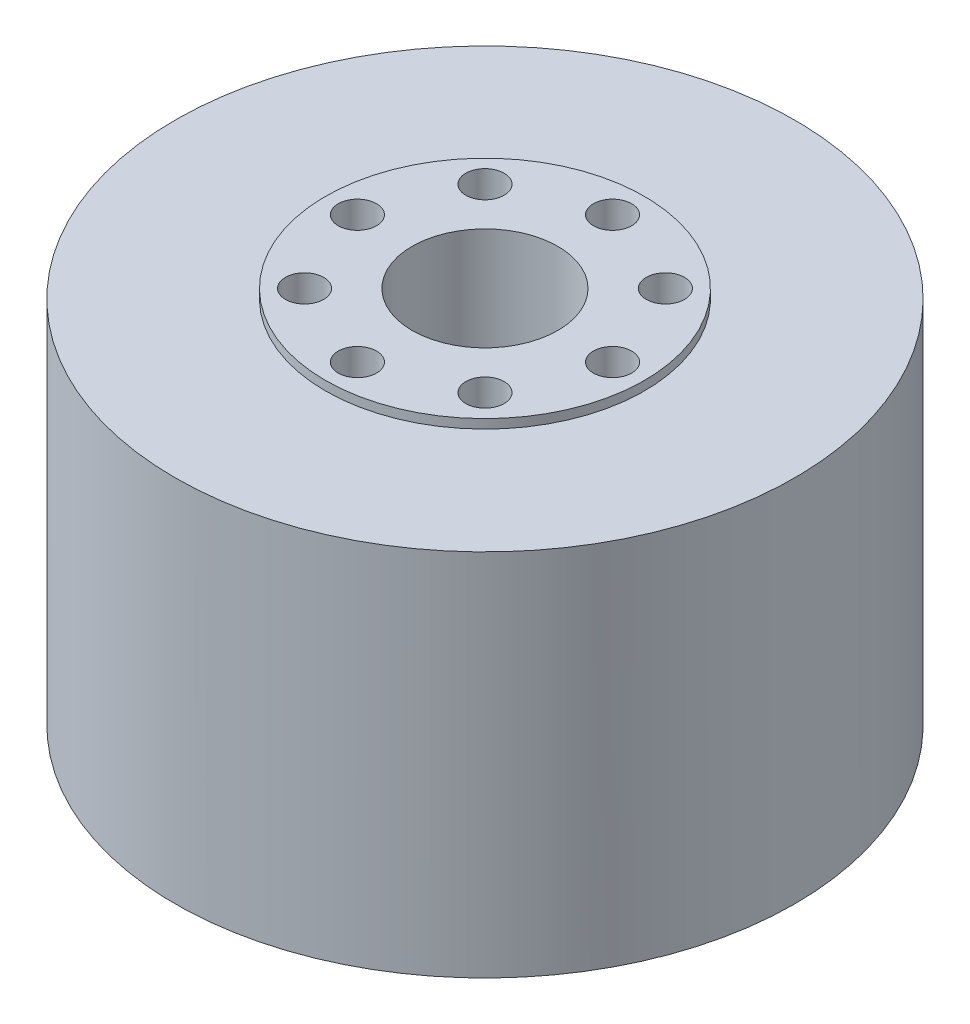
from build123d import *

# Parameters (mm, degrees)
SKETCH_1_R          = 34
SKETCH_1_R_2        = 8
EXTRUDE_1_DEPTH     = 40.5
SKETCH_2_R          = 17.5
SKETCH_2_R_2        = 8
EXTRUDE_2_DEPTH     = 1
SKETCH_3_R          = 2.1
CUT_EXTRUDE_1_DEPTH = 5
CUT_EXTRUDE_2_DEPTH = 8
SKETCH_5_R          = 2.1
CUT_EXTRUDE_3_DEPTH = 5


with BuildPart() as part:
    # 草图1 → 凸台-拉伸1 (new body)
    with BuildSketch(Plane(origin=(0, 0, 0), x_dir=(1, 0, 0), z_dir=(0, 1, 0))):
        with Locations(Location((0, 0, 0), (0, 0, 270))):
            Circle(SKETCH_1_R)
        with Locations(Location((0, 0, 0), (0, 0, 270))):
            Circle(SKETCH_1_R_2, mode=Mode.SUBTRACT)
    extrude(amount=EXTRUDE_1_DEPTH)

    # 草图2 → 凸台-拉伸2 (add)
    with BuildSketch(Plane(origin=(0, 40.5, 0), x_dir=(1, 0, 0), z_dir=(0, 1, 0))):
        with Locations(Location((0, 0, 0), (0, 0, 270))):
            Circle(SKETCH_2_R)
        with Locations(Location((0, 0, 0), (0, 0, 270))):
            Circle(SKETCH_2_R_2, mode=Mode.SUBTRACT)
    extrude(amount=EXTRUDE_2_DEPTH)

    # 草图3 → 切除-拉伸1 (cut)
    with BuildSketch(Plane(origin=(0, 41.5, 0), x_dir=(1, 0, 0), z_dir=(0, 1, 0))):
        with Locations(Location((14, 0, 0), (0, 0, 270))):
            Circle(SKETCH_3_R)
        with Locations(Location((9.899494937, -9.899494937, 0), (0, 0, 270))):
            Circle(SKETCH_3_R)
        with Locations(Location((0, -14, 0), (0, 0, 270))):
            Circle(SKETCH_3_R)
        with Locations(Location((-9.899494937, -9.899494937, 0), (0, 0, 270))):
            Circle(SKETCH_3_R)
        with Locations(Location((-14, 0, 0), (0, 0, 270))):
            Circle(SKETCH_3_R)
        with Locations(Location((-9.899494937, 9.899494937, 0), (0, 0, 270))):
            Circle(SKETCH_3_R)
        with Locations(Location((0, 14, 0), (0, 0, 270))):
            Circle(SKETCH_3_R)
        with Locations(Location((9.899494937, 9.899494937, 0), (0, 0, 270))):
            Circle(SKETCH_3_R)
    extrude(amount=-CUT_EXTRUDE_1_DEPTH, mode=Mode.SUBTRACT)

    # 草图4 → 切除-拉伸2 (cut)
    with BuildSketch(Plane(origin=(0, 0, 0), x_dir=(-1, 0, 0), z_dir=(0, -1, 0))):
        Polygon((28.844410204, 191.136996342), (28.844410204, 18), (28.844410204, -18), (28.844410204, -191.136996342), (375.118402887, -191.136996342), (375.118402887, 191.136996342), align=None)
    extrude(amount=-CUT_EXTRUDE_2_DEPTH, mode=Mode.SUBTRACT)

    # 草图5 → 切除-拉伸3 (cut)
    with BuildSketch(Plane(origin=(0, 0, 0), x_dir=(-1, 0, 0), z_dir=(0, -1, 0))):
        with Locations(Location((-30, 0, 0), (0, 0, 90))):
            Circle(SKETCH_5_R)
        with Locations(Location((15, 25.980762114, 0), (0, 0, 90))):
            Circle(SKETCH_5_R)
        with Locations(Location((15, -25.980762114, 0), (0, 0, 90))):
            Circle(SKETCH_5_R)
    extrude(amount=-CUT_EXTRUDE_3_DEPTH, mode=Mode.SUBTRACT)


solid = part.part
